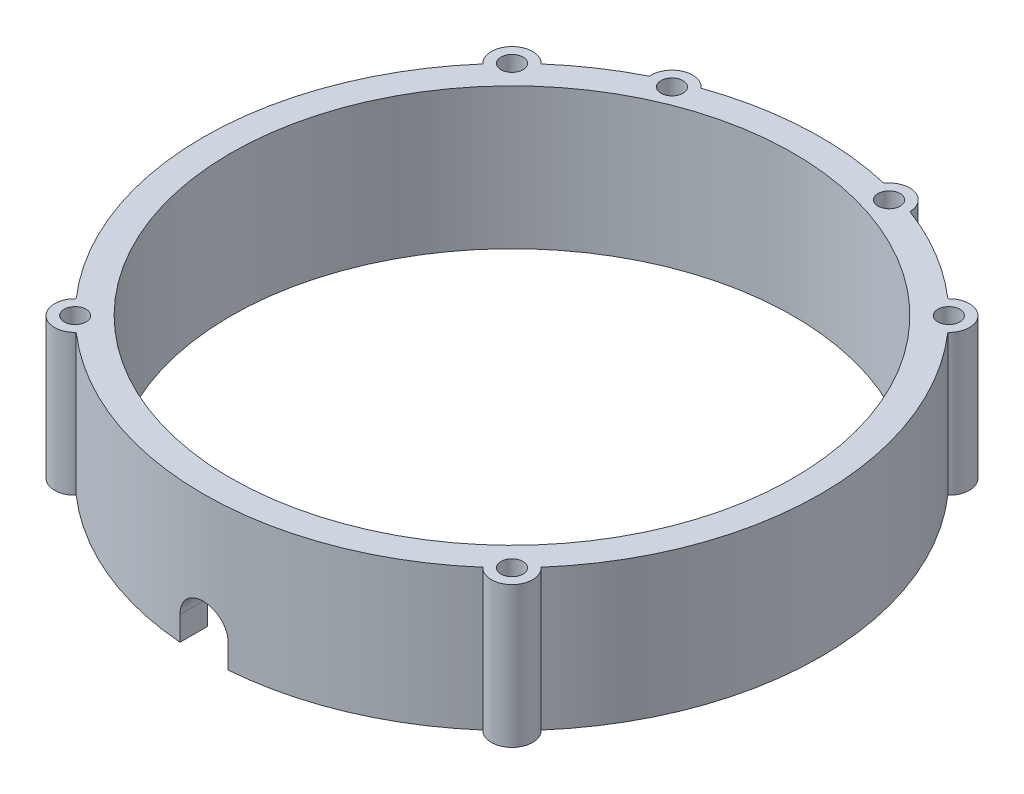
from build123d import *
from build123d.topology import SkipClean

# Parameters (mm, degrees)
SKETCH_1_R          = 46.9
SKETCH_1_R_2        = 40.9
SKETCH_1_R_3        = 1.6
EXTRUDE_1_DEPTH     = 20.5
SKETCH_2_R          = 3
EXTRUDE_2_DEPTH     = 20.5
SKETCH_3_R          = 1.6
CUT_EXTRUDE_1_DEPTH = 25
CUT_EXTRUDE_START   = -25
CUT_EXTRUDE_2_DEPTH = 25
CUT_EXTRUDE_3_DEPTH = 67.780389508


with BuildPart() as part:
    # 草图1 → 凸台-拉伸1 (new body)
    with BuildSketch(Plane(origin=(0, 0, 0), x_dir=(1, 0, 0), z_dir=(0, 1, 0))):
        with Locations(Location((0, 0, 0), (0, 0, 270))):
            Circle(SKETCH_1_R)
        with Locations(Location((0, 0, 0), (0, 0, 270))):
            Circle(SKETCH_1_R_2, mode=Mode.SUBTRACT)
        with Locations(Location((12.835117837, 41.981778787, 0), (0, 0, 270))):
            Circle(SKETCH_1_R_3, mode=Mode.SUBTRACT)
        with Locations(Location((-17.153096541, 40.410163067, 0), (0, 0, 270))):
            Circle(SKETCH_1_R_3, mode=Mode.SUBTRACT)
    extrude(amount=EXTRUDE_1_DEPTH)

    # 草图2 → 凸台-拉伸2 (add)
    with BuildSketch(Plane(origin=(0, 20.5, 0), x_dir=(1, 0, 0), z_dir=(0, 1, 0))):
        with Locations((31.749094475, 31.749094475)):
            Circle(SKETCH_2_R)
        with Locations((31.749094475, -31.749094475)):
            Circle(SKETCH_2_R)
        with Locations((-31.749094475, -31.749094475)):
            Circle(SKETCH_2_R)
        with Locations((-31.749094475, 31.749094475)):
            Circle(SKETCH_2_R)
    extrude(amount=-EXTRUDE_2_DEPTH)

    # 草图3 → 切除-拉伸1 (cut)
    with BuildSketch(Plane(origin=(0, 20.5, 0), x_dir=(1, 0, 0), z_dir=(0, 1, 0))):
        with Locations(Location((-31.749094475, 31.749094475, 0), (0, 0, 270))):
            Circle(SKETCH_3_R)
        with Locations(Location((-31.749094475, -31.749094475, 0), (0, 0, 270))):
            Circle(SKETCH_3_R)
        with Locations(Location((31.749094475, -31.749094475, 0), (0, 0, 270))):
            Circle(SKETCH_3_R)
        with Locations(Location((31.749094475, 31.749094475, 0), (0, 0, 270))):
            Circle(SKETCH_3_R)
    extrude(amount=-CUT_EXTRUDE_1_DEPTH, mode=Mode.SUBTRACT)

    # 草图4 → 切除-拉伸2 (cut)
    with SkipClean():  # the faces are left unmerged after this step: merging them gives an invalid solid
        with BuildSketch(Plane(origin=(0, 20.5, 0), x_dir=(1, 0, 0), z_dir=(0, 1, 0)).offset(CUT_EXTRUDE_START)):
            with BuildLine():
                ThreePointArc((-20.139957039, 40.129691383), (-19.729499495, 41.947091113), (-18.325289788, 43.171677686))
                ThreePointArc((-18.325289788, 43.171677686), (-25.271051327, 39.509289602), (-31.508446668, 34.739427004))
                ThreePointArc((-31.508446668, 34.739427004), (-30.445394472, 34.451013479), (-29.558090066, 33.798362559))
                ThreePointArc((-29.558090066, 33.798362559), (-25.049858336, 37.262777638), (-20.139957039, 40.129691383))
            make_face()
            with BuildLine():
                ThreePointArc((10.366766227, 43.686841932), (11.849397191, 44.815213947), (13.71223353, 44.850692878))
                ThreePointArc((13.71223353, 44.850692878), (-2.454555971, 46.8357252), (-18.325289788, 43.171677686))
                ThreePointArc((-18.325289788, 43.171677686), (-16.468950031, 43.331112151), (-14.876494449, 42.363898698))
                ThreePointArc((-14.876494449, 42.363898698), (-2.349884435, 44.83846611), (10.366766227, 43.686841932))
            make_face()
            with BuildLine():
                ThreePointArc((29.558090066, 33.798362559), (30.445394472, 34.451013479), (31.508446668, 34.739427004))
                ThreePointArc((31.508446668, 34.739427004), (23.168662106, 40.777727943), (13.71223353, 44.850692878))
                ThreePointArc((13.71223353, 44.850692878), (15.236754486, 43.77959452), (15.834933275, 42.015055494))
                ThreePointArc((15.834933275, 42.015055494), (23.065345276, 38.522718586), (29.558090066, 33.798362559))
            make_face()
            with BuildLine():
                ThreePointArc((33.798362559, -29.558090066), (44.9, 0), (33.798362559, 29.558090066))
                ThreePointArc((33.798362559, 29.558090066), (34.451013479, 30.445394472), (34.739427004, 31.508446668))
                ThreePointArc((34.739427004, 31.508446668), (46.9, 0), (34.739427004, -31.508446668))
                ThreePointArc((34.739427004, -31.508446668), (34.451013479, -30.445394472), (33.798362559, -29.558090066))
            make_face()
            with BuildLine():
                ThreePointArc((-33.798362559, -29.558090066), (-34.451013479, -30.445394472), (-34.739427004, -31.508446668))
                ThreePointArc((-34.739427004, -31.508446668), (-46.9, 0), (-34.739427004, 31.508446668))
                ThreePointArc((-34.739427004, 31.508446668), (-34.451013479, 30.445394472), (-33.798362559, 29.558090066))
                ThreePointArc((-33.798362559, 29.558090066), (-44.9, 0), (-33.798362559, -29.558090066))
            make_face()
            with BuildLine():
                ThreePointArc((-31.508446668, -34.739427004), (-30.445394472, -34.451013479), (-29.558090066, -33.798362559))
                ThreePointArc((-29.558090066, -33.798362559), (0, -44.9), (29.558090066, -33.798362559))
                ThreePointArc((29.558090066, -33.798362559), (30.445394472, -34.451013479), (31.508446668, -34.739427004))
                ThreePointArc((31.508446668, -34.739427004), (0, -46.9), (-31.508446668, -34.739427004))
            make_face()
        extrude(amount=CUT_EXTRUDE_2_DEPTH, mode=Mode.SUBTRACT)

    # 草图5 → 切除-拉伸3 (cut, through all)
    with SkipClean():  # the faces are left unmerged after this step: merging them gives an invalid solid
        with BuildSketch(Plane.XY):
            with BuildLine():
                Line((-3.5, 3.5), (-3.5, 0))
                Line((-3.5, 0), (3.5, 0))
                Line((3.5, 0), (3.5, 3.5))
                ThreePointArc((3.5, 3.5), (0, 7), (-3.5, 3.5))
            make_face()
        extrude(amount=CUT_EXTRUDE_3_DEPTH, mode=Mode.SUBTRACT)


solid = part.part
